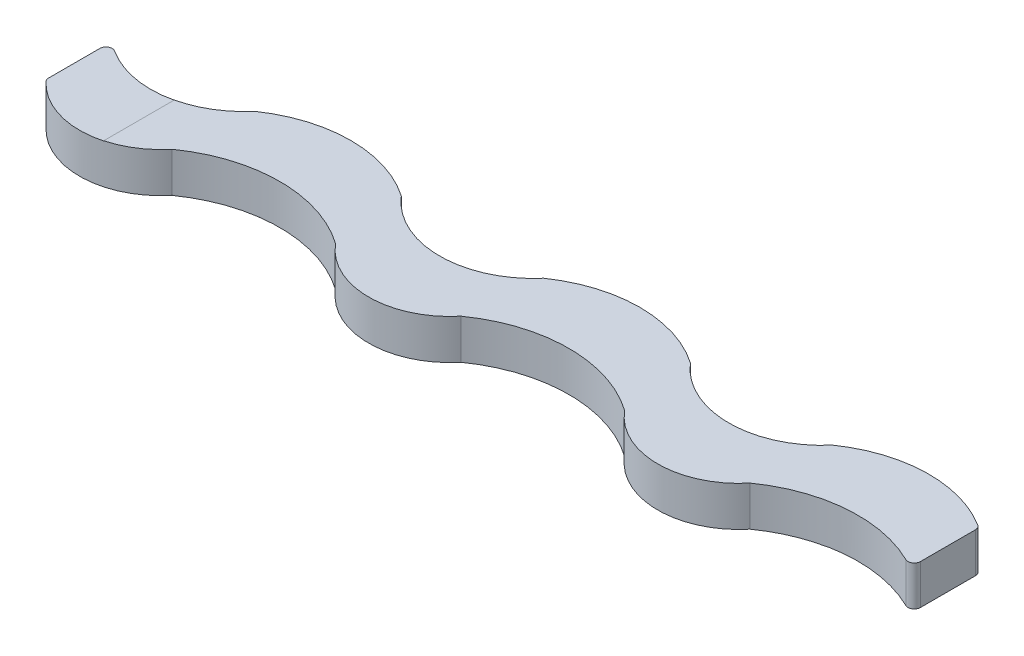
from build123d import *

# Parameters (mm, degrees)
BOSS_EXTRUDE1_DEPTH = 3.2
SKETCH2_W           = 75.494873271
SKETCH2_H           = 16.574066579
CUT_EXTRUDE1_DEPTH  = 3.2
FILLET1_R           = 0.5
SKETCH3_W           = 8.055614235
SKETCH3_H           = 25.854685688
CUT_EXTRUDE2_DEPTH  = 0.01
SKETCH4_W           = 14.500105624
SKETCH4_H           = 31.26063467
CUT_EXTRUDE3_DEPTH  = 0.01


with BuildPart() as part:
    # Sketch1 → Boss-Extrude1 (new body)
    with BuildSketch(Plane(origin=(0, 0, 0), x_dir=(1, 0, 0), z_dir=(0, 1, 0))):
        with BuildLine():
            ThreePointArc((51.666035076, -4.495071474), (57.875, -2.537392354), (64.083964924, -4.495071474))
            Line((64.083964924, -4.495071474), (64.083964924, -11.181167218))
            ThreePointArc((64.083964924, -11.181167218), (57.875, -9.223488098), (51.666035076, -11.181167218))
            ThreePointArc((51.666035076, -11.181167218), (46.3, -13.686095744), (40.933964924, -11.181167218))
            ThreePointArc((40.933964924, -11.181167218), (34.725, -9.223488098), (28.516035077, -11.181167218))
            ThreePointArc((28.516035077, -11.181167218), (23.15, -13.686095744), (17.783964924, -11.181167218))
            ThreePointArc((17.783964924, -11.181167218), (11.575, -9.223488098), (5.366035077, -11.181167218))
            ThreePointArc((5.366035077, -11.181167218), (0, -13.686095744), (-5.366035076, -11.181167218))
            Line((-5.366035076, -11.181167218), (-5.366035076, -4.495071474))
            ThreePointArc((-5.366035076, -4.495071474), (0, -7), (5.366035076, -4.495071474))
            ThreePointArc((5.366035076, -4.495071474), (11.575, -2.537392354), (17.783964924, -4.495071474))
            ThreePointArc((17.783964924, -4.495071474), (23.15, -7), (28.516035076, -4.495071474))
            ThreePointArc((28.516035076, -4.495071474), (34.725, -2.537392354), (40.933964924, -4.495071474))
            ThreePointArc((40.933964924, -4.495071474), (46.3, -7), (51.666035076, -4.495071474))
        make_face()
    extrude(amount=BOSS_EXTRUDE1_DEPTH)

    # Sketch2 → Cut-Extrude1 (cut)
    with BuildSketch(Plane(origin=(0, 3.2, 0), x_dir=(1, 0, 0), z_dir=(0, 1, 0))):
        with Locations((29.270514079, -6.984979931)):
            Rectangle(SKETCH2_W, SKETCH2_H)
        with BuildLine():
            Line((63.583964924, -10.267724094), (63.583964924, -4.759291488))
            ThreePointArc((63.583964924, -4.759291488), (57.778030808, -3.037847716), (52.005454008, -4.868038061))
            ThreePointArc((52.005454008, -4.868038061), (46.3, -7.5), (40.594545992, -4.868038061))
            ThreePointArc((40.594545992, -4.868038061), (34.725, -3.037392354), (28.855454008, -4.868038061))
            ThreePointArc((28.855454008, -4.868038061), (23.15, -7.5), (17.444545992, -4.868038061))
            ThreePointArc((17.444545992, -4.868038061), (11.575, -3.037392354), (5.705454008, -4.868038061))
            ThreePointArc((5.705454008, -4.868038061), (0.593454673, -7.476483903), (-4.866035076, -5.707162398))
            Line((-4.866035076, -5.707162398), (-4.866035076, -10.995585579))
            ThreePointArc((-4.866035076, -10.995585579), (0.121449449, -13.184961032), (5.023650974, -10.810769172))
            ThreePointArc((5.023650974, -10.810769172), (11.575, -8.723488098), (18.126349026, -10.810769172))
            ThreePointArc((18.126349026, -10.810769172), (23.15, -13.186095744), (28.173650974, -10.810769172))
            ThreePointArc((28.173650974, -10.810769172), (34.725, -8.723488098), (41.276349026, -10.810769172))
            ThreePointArc((41.276349026, -10.810769172), (46.3, -13.186095744), (51.323650974, -10.810769172))
            ThreePointArc((51.323650974, -10.810769172), (57.373874034, -8.734580825), (63.583964924, -10.267724094))
        make_face(mode=Mode.SUBTRACT)
    extrude(amount=-CUT_EXTRUDE1_DEPTH, mode=Mode.SUBTRACT)

    # Fillet1
    fillet1_edges = [part.edges().sort_by_distance(p)[0] for p in [
        (63.583964924, 1.6, 10.267724094),
        (63.583964924, 1.6, 4.759291488),
        (-4.866035076, 1.6, 5.707162398),
        (-4.866035076, 1.6, 10.995585579),
    ]]
    fillet(fillet1_edges, radius=FILLET1_R)

    # Sketch3 → Cut-Extrude2 (cut)
    with BuildSketch(Plane.XZ):
        with Locations((59.701778543, 14.32607503)):
            Rectangle(SKETCH3_W, SKETCH3_H)
    extrude(amount=-CUT_EXTRUDE2_DEPTH, mode=Mode.SUBTRACT)

    # Sketch4 → Cut-Extrude3 (cut)
    with BuildSketch(Plane(origin=(0, 3.2, 0), x_dir=(1, 0, 0), z_dir=(0, 1, 0))):
        with Locations((-5.548696762, 0)):
            Rectangle(SKETCH4_W, SKETCH4_H)
    extrude(amount=-CUT_EXTRUDE3_DEPTH, mode=Mode.SUBTRACT)


solid = part.part
